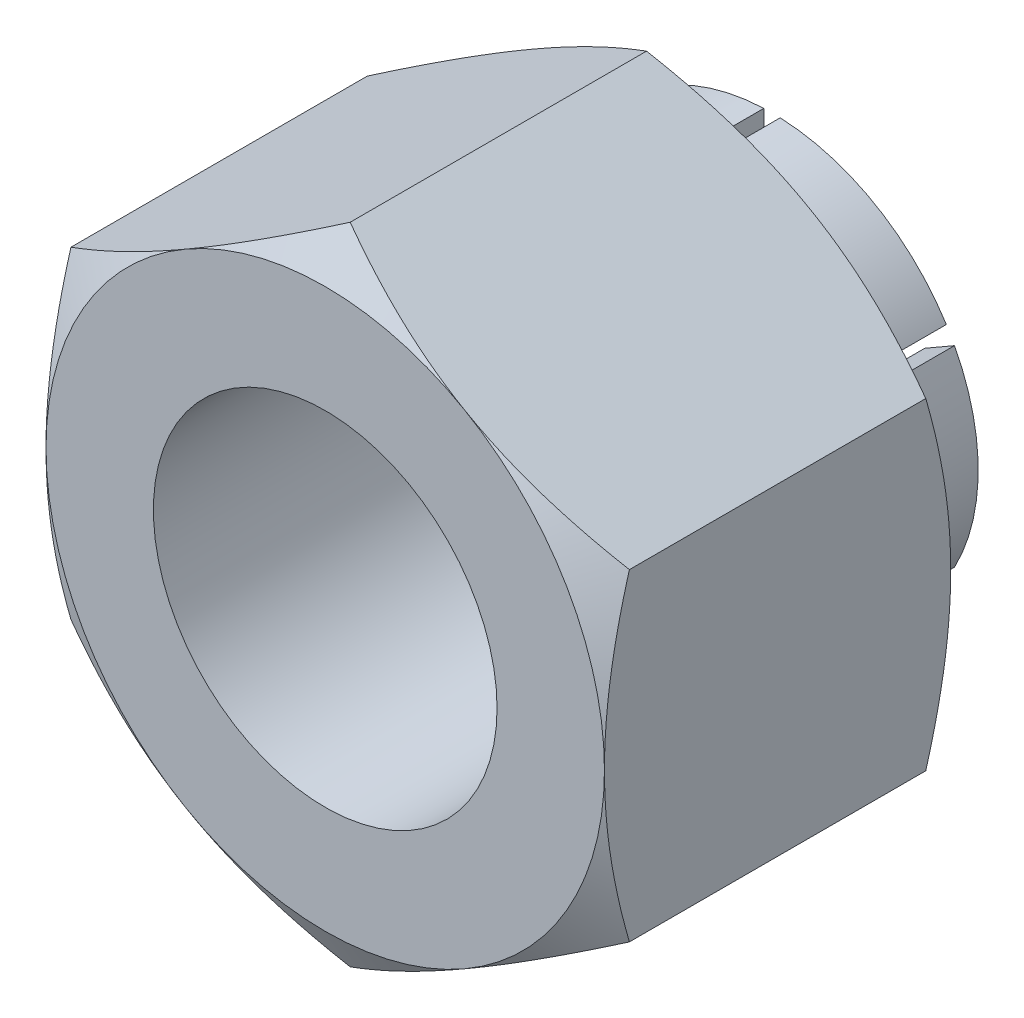
from build123d import *

# Parameters (mm, degrees)
EXTRUDE1_DEPTH          = 10.4
SKETCH2_OUTSIDE_W       = 72.756
SKETCH2_OUTSIDE_H       = 74.768
SKETCH2_OUTSIDE_R       = 6.5
CUT_EXTRUDE1_DEPTH      = 15.37857202
CUT_EXTRUDE1_DRAFT      = -60
SKETCH4_R               = 4
CUT_EXTRUDE3_DEPTH      = 15.37857202
SKETCH12_OUTSIDE_W      = 19.484
SKETCH12_OUTSIDE_H      = 21.496
SKETCH12_OUTSIDE_R      = 4.8
CUT_EXTRUDE10_DEPTH     = 2.34
SKETCH15_W              = 0.381
SKETCH15_H              = 7.505553499
CUT_EXTRUDE_THIN2_DEPTH = 1.832
CIRPATTERN1_COUNT       = 6
SKETCH3_OUTSIDE_W       = 67.248
SKETCH3_OUTSIDE_H       = 69.26
SKETCH3_OUTSIDE_R       = 6.5
CUT_EXTRUDE2_DEPTH      = 13.788546959
CUT_EXTRUDE2_DRAFT      = -60


with BuildPart() as part:
    # Sketch1 → Extrude1 (new body)
    with BuildSketch(Plane.XY):
        Polygon((0, 7.505553499), (-6.5, 3.75277675), (-6.5, -3.75277675), (0, -7.505553499), (6.5, -3.75277675), (6.5, 3.75277675), align=None)
    extrude(amount=-EXTRUDE1_DEPTH)


with BuildPart() as cut_extrude1_tool:
    # Sketch2 outside → Cut-Extrude1 (with draft: the straight prism first)
    with BuildSketch(Plane.XY):
        Rectangle(SKETCH2_OUTSIDE_W, SKETCH2_OUTSIDE_H)
        Circle(SKETCH2_OUTSIDE_R, mode=Mode.SUBTRACT)
    extrude(amount=-CUT_EXTRUDE1_DEPTH)
    # Cut-Extrude1: the draft: its side faces are tilted about the plane it starts from
    cut_extrude1_sides = [cut_extrude1_tool.faces().sort_by_distance(p)[0] for p in [
        (0, -37.384, -7.68928601),
        (36.378, 0, -7.68928601),
        (0, 37.384, -7.68928601),
        (-36.378, 0, -7.68928601),
        (-6.5, 0, -7.68928601),
    ]]
    draft(cut_extrude1_sides, Plane.XY, CUT_EXTRUDE1_DRAFT)


with BuildPart() as part_1:
    add(part.part)

    # Cut-Extrude1: cut by cut_extrude1_tool
    add(cut_extrude1_tool.part, mode=Mode.SUBTRACT)

    # Sketch4 → Cut-Extrude3 (cut, through all)
    with BuildSketch(Plane.XY):
        Circle(SKETCH4_R)
    extrude(amount=-CUT_EXTRUDE3_DEPTH, mode=Mode.SUBTRACT)

    # Sketch12 outside → Cut-Extrude10 (cut)
    with BuildSketch(Plane(origin=(0, 0, -10.4), x_dir=(-1, 0, 0), z_dir=(0, 0, -1))):
        Rectangle(SKETCH12_OUTSIDE_W, SKETCH12_OUTSIDE_H)
        Circle(SKETCH12_OUTSIDE_R, mode=Mode.SUBTRACT)
    extrude(amount=-CUT_EXTRUDE10_DEPTH, mode=Mode.SUBTRACT)

    # Sketch15 → Cut-Extrude-Thin2 (cut)
    with BuildSketch(Plane(origin=(0, 0, -10.4), x_dir=(-1, 0, 0), z_dir=(0, 0, -1))):
        with Locations((0, -3.75277675)):
            Rectangle(SKETCH15_W, SKETCH15_H)
    cut_extrude_thin2 = extrude(amount=-CUT_EXTRUDE_THIN2_DEPTH, mode=Mode.SUBTRACT)

    # CirPattern1: Cut-Extrude-Thin2 ×6 about axis
    cirpattern1_axis = Axis((0, 0, 0), (0, 0, 1))
    for i in range(1, CIRPATTERN1_COUNT):
        add(cut_extrude_thin2.rotate(cirpattern1_axis, i * 360 / CIRPATTERN1_COUNT), mode=Mode.SUBTRACT)


with BuildPart() as cut_extrude2_tool:
    # Sketch3 outside → Cut-Extrude2 (with draft: the straight prism first)
    with BuildSketch(Plane(origin=(0, 0, -8.06), x_dir=(-1, 0, 0), z_dir=(0, 0, -1))):
        Rectangle(SKETCH3_OUTSIDE_W, SKETCH3_OUTSIDE_H)
        Circle(SKETCH3_OUTSIDE_R, mode=Mode.SUBTRACT)
    extrude(amount=-CUT_EXTRUDE2_DEPTH)
    # Cut-Extrude2: the draft: its side faces are tilted about the plane it starts from
    cut_extrude2_sides = [cut_extrude2_tool.faces().sort_by_distance(p)[0] for p in [
        (0, -34.63, -1.16572652),
        (-33.624, 0, -1.16572652),
        (0, 34.63, -1.16572652),
        (33.624, 0, -1.16572652),
        (6.5, 0, -1.16572652),
    ]]
    draft(cut_extrude2_sides, Plane(origin=(0, 0, -8.06), x_dir=(-1, 0, 0), z_dir=(0, 0, -1)), CUT_EXTRUDE2_DRAFT)


with BuildPart() as part_2:
    add(part_1.part)

    # Cut-Extrude2: cut by cut_extrude2_tool
    add(cut_extrude2_tool.part, mode=Mode.SUBTRACT)


solid = part_2.part
